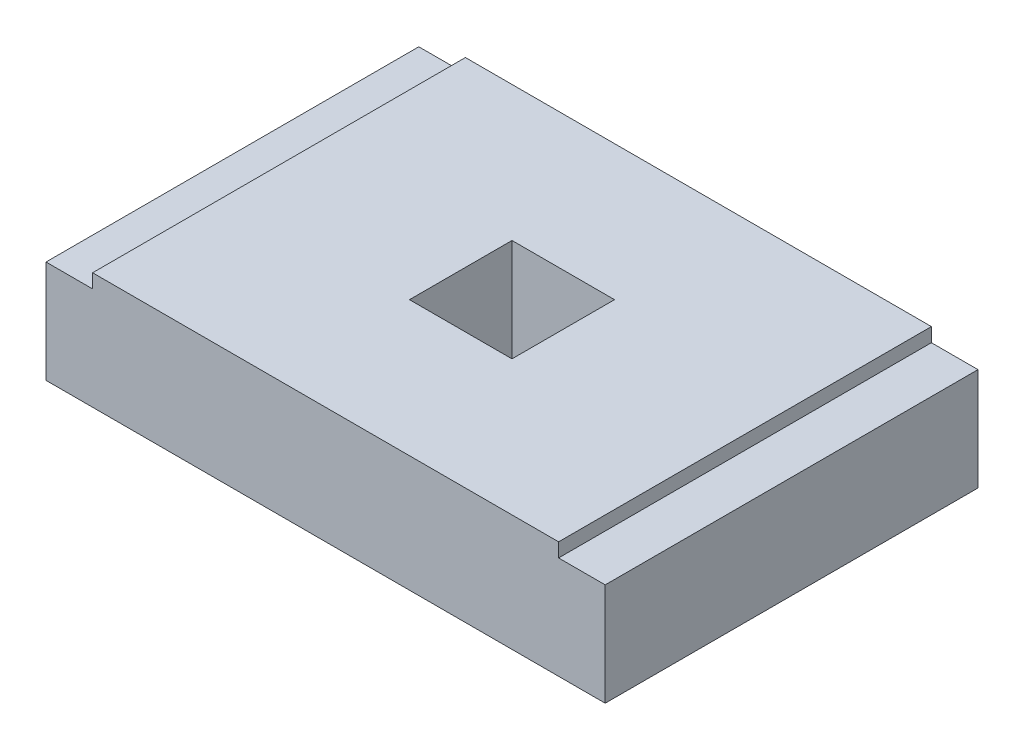
from build123d import *

# Parameters (mm, degrees)
SKETCH1_W           = 100
SKETCH1_H           = 3
BOSS_EXTRUDE1_DEPTH = 40
SKETCH2_W           = 22
SKETCH2_H           = 22
CUT_EXTRUDE1_DEPTH  = 77.321687612


with BuildPart() as part:
    # Sketch1 → Boss-Extrude1 (new, symmetric)
    with BuildSketch(Plane.XY):
        Polygon((50, 9.5), (-50, 9.5), (-60, 9.5), (-60, -12.5), (60, -12.5), (60, 9.5), align=None)
        with Locations((0, 11)):
            Rectangle(SKETCH1_W, SKETCH1_H)
    extrude(amount=BOSS_EXTRUDE1_DEPTH, both=True)

    # Sketch2 → Cut-Extrude1 (cut, through all)
    with BuildSketch(Plane(origin=(0, 12.5, 0), x_dir=(1, 0, 0), z_dir=(0, 1, 0))):
        Rectangle(SKETCH2_W, SKETCH2_H)
    extrude(amount=-CUT_EXTRUDE1_DEPTH, mode=Mode.SUBTRACT)


solid = part.part
